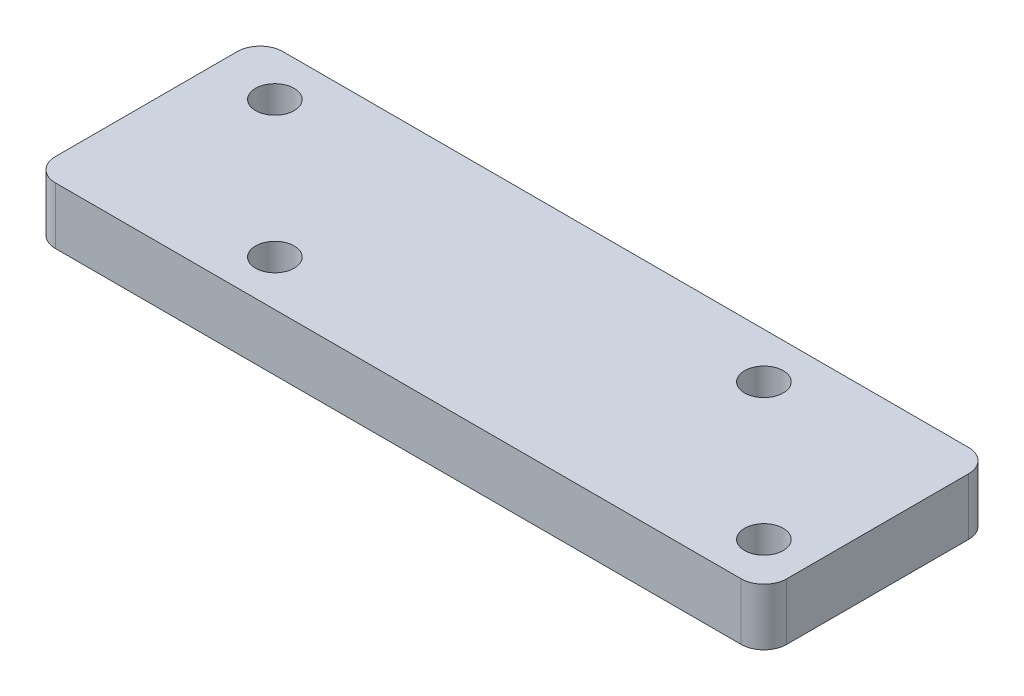
from build123d import *

# Parameters (mm, degrees)
SKETCH_1_W      = 64.3
SKETCH_1_H      = 20
SKETCH_1_R      = 1.7
EXTRUDE_1_DEPTH = 5
FILLET_1_R      = 2


with BuildPart() as part:
    # 草图1 → 凸台-拉伸1 (new body)
    with BuildSketch(Plane(origin=(0, 0, 0), x_dir=(1, 0, 0), z_dir=(0, 1, 0))):
        with Locations((32.15, 10)):
            Rectangle(SKETCH_1_W, SKETCH_1_H)
        with Locations(Location((5.3, 16, 0), (0, 0, 270))):
            Circle(SKETCH_1_R, mode=Mode.SUBTRACT)
        with Locations(Location((17.3, 4, 0), (0, 0, 270))):
            Circle(SKETCH_1_R, mode=Mode.SUBTRACT)
        with Locations(Location((48.3, 16, 0), (0, 0, 270))):
            Circle(SKETCH_1_R, mode=Mode.SUBTRACT)
        with Locations(Location((60.3, 4, 0), (0, 0, 270))):
            Circle(SKETCH_1_R, mode=Mode.SUBTRACT)
    extrude(amount=EXTRUDE_1_DEPTH)

    # 圆角1
    fillet_1_edges = [part.edges().sort_by_distance(p)[0] for p in [
        (0, 2.5, -20),
        (64.3, 2.5, -20),
        (64.3, 2.5, 0),
        (0, 2.5, 0),
    ]]
    fillet(fillet_1_edges, radius=FILLET_1_R)


solid = part.part
